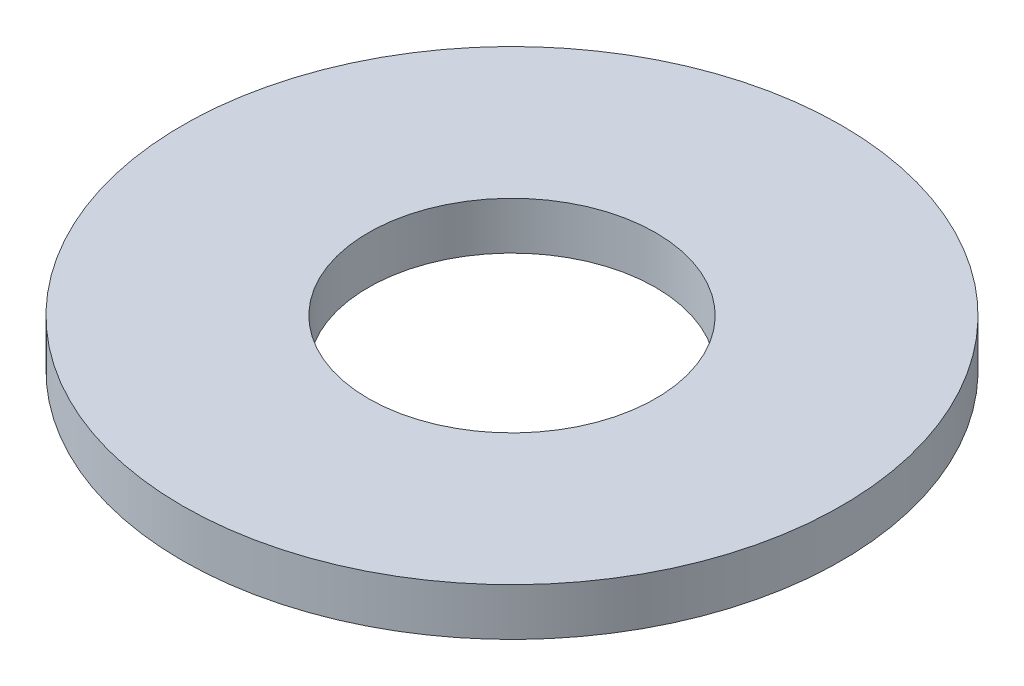
from build123d import *

# Parameters (mm, degrees)
SKETCH1_R           = 3.175
BOSS_EXTRUDE1_DEPTH = 0.4572
SKETCH5_R           = 1.3843
CUT_EXTRUDE1_DEPTH  = 5.513344862


with BuildPart() as part:
    # Sketch1 → Boss-Extrude1 (new body)
    with BuildSketch(Plane(origin=(0, 0, 0), x_dir=(1, 0, 0), z_dir=(0, 1, 0))):
        with Locations(Location((0, 0, 0), (0, 0, 270))):
            Circle(SKETCH1_R)
    extrude(amount=BOSS_EXTRUDE1_DEPTH)

    # Sketch5 → Cut-Extrude1 (cut, through all)
    with BuildSketch(Plane(origin=(0, 0.4572, 0), x_dir=(-1, 0, 0), z_dir=(0, 1, 0))):
        with Locations(Location((0, 0, 0), (0, 0, 90))):
            Circle(SKETCH5_R)
    extrude(amount=-CUT_EXTRUDE1_DEPTH, mode=Mode.SUBTRACT)


solid = part.part
